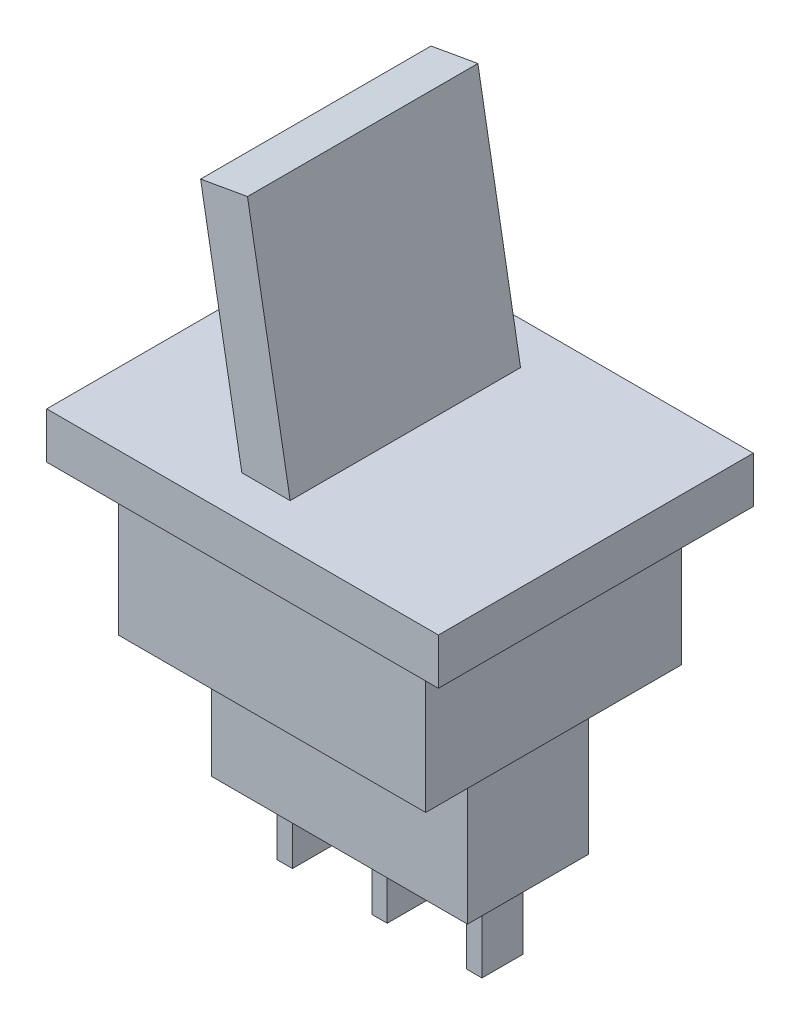
from build123d import *

# Parameters (mm, degrees)
SKETCH1_W                = 19.43
SKETCH1_H                = 15.62
BOSS_EXTRUDE1_DEPTH      = 2.29
SKETCH5_W                = 15.25
SKETCH5_H                = 12.7
BOSS_EXTRUDE2_DEPTH      = 7.11
SKETCH6_W                = 12.7
SKETCH6_H                = 6
BOSS_EXTRUDE3_DEPTH      = 7.11
SKETCH7_W                = 0.76
SKETCH7_H                = 2.03
BOSS_EXTRUDE4_DEPTH      = 3.94
BOSS_EXTRUDE5_DEPTH      = 5.715
BOSS_EXTRUDE5_DEPTH_BACK = 5.715


with BuildPart() as part:
    # Sketch1 → Boss-Extrude1 (new body)
    with BuildSketch(Plane(origin=(0, 0, 0), x_dir=(1, 0, 0), z_dir=(0, 1, 0))):
        Rectangle(SKETCH1_W, SKETCH1_H)
    extrude(amount=BOSS_EXTRUDE1_DEPTH)

    # Sketch5 → Boss-Extrude2 (add)
    with BuildSketch(Plane.XZ):
        Rectangle(SKETCH5_W, SKETCH5_H)
    extrude(amount=BOSS_EXTRUDE2_DEPTH)

    # Sketch6 → Boss-Extrude3 (add)
    with BuildSketch(Plane.XZ.offset(7.11)):
        Rectangle(SKETCH6_W, SKETCH6_H)
    extrude(amount=BOSS_EXTRUDE3_DEPTH)

    # Sketch7 → Boss-Extrude4 (add)
    with BuildSketch(Plane.XZ.offset(14.22)):
        Rectangle(SKETCH7_W, SKETCH7_H)
        with Locations((-4.7, 0)):
            Rectangle(SKETCH7_W, SKETCH7_H)
        with Locations((4.7, 0)):
            Rectangle(SKETCH7_W, SKETCH7_H)
    extrude(amount=BOSS_EXTRUDE4_DEPTH)

    # Sketch8 → Boss-Extrude5 (add, two sides: drawn at the far end of the back side and taken through both)
    with BuildSketch(Plane.XY.offset(-BOSS_EXTRUDE5_DEPTH_BACK)):
        Polygon((-1.162073149, -3.20490485), (1.162073149, -2.79509515), (-1.851354952, 14.29490485), (-4.175501249, 13.88509515), align=None)
    extrude(amount=BOSS_EXTRUDE5_DEPTH + BOSS_EXTRUDE5_DEPTH_BACK)


solid = part.part
